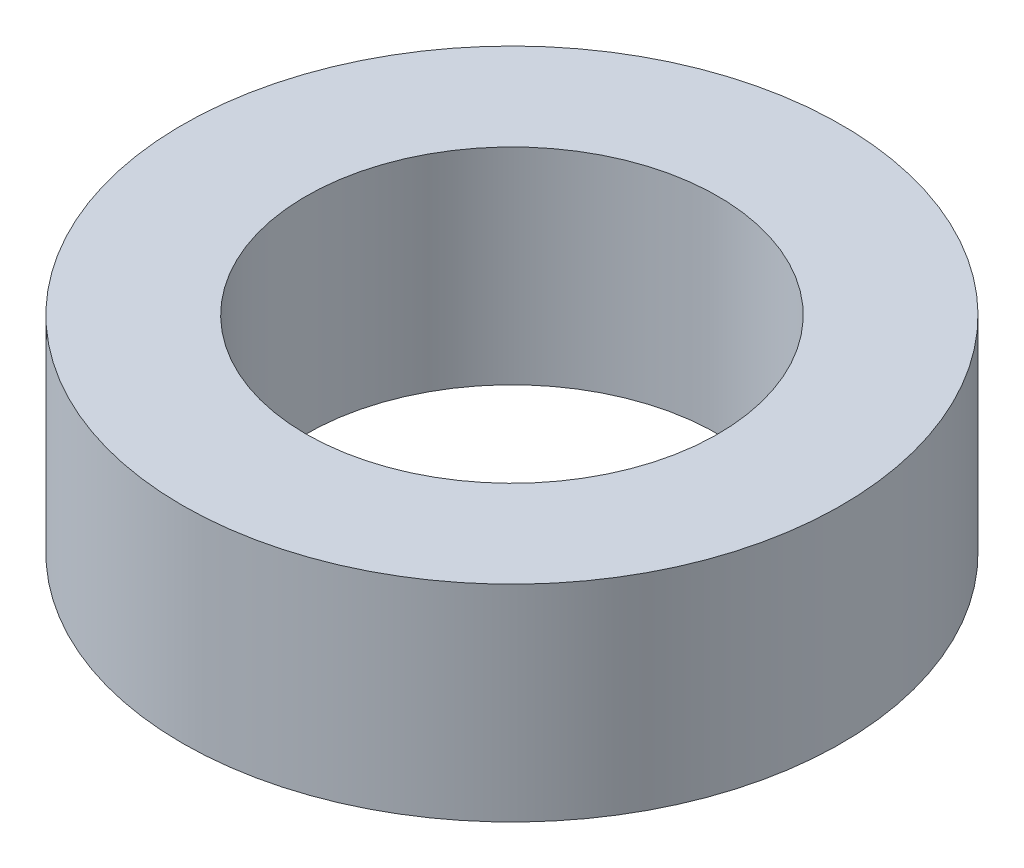
from build123d import *

# Parameters (mm, degrees)
SKETCH1_R           = 4
SKETCH1_R_2         = 2.5
BOSS_EXTRUDE1_DEPTH = 2.5


with BuildPart() as part:
    # Sketch1 → Boss-Extrude1 (new body)
    with BuildSketch(Plane(origin=(0, 0, 0), x_dir=(1, 0, 0), z_dir=(0, 1, 0))):
        with Locations(Location((0, 0, 0), (0, 0, 270))):
            Circle(SKETCH1_R)
        with Locations(Location((0, 0, 0), (0, 0, 270))):
            Circle(SKETCH1_R_2, mode=Mode.SUBTRACT)
    extrude(amount=BOSS_EXTRUDE1_DEPTH)


solid = part.part
